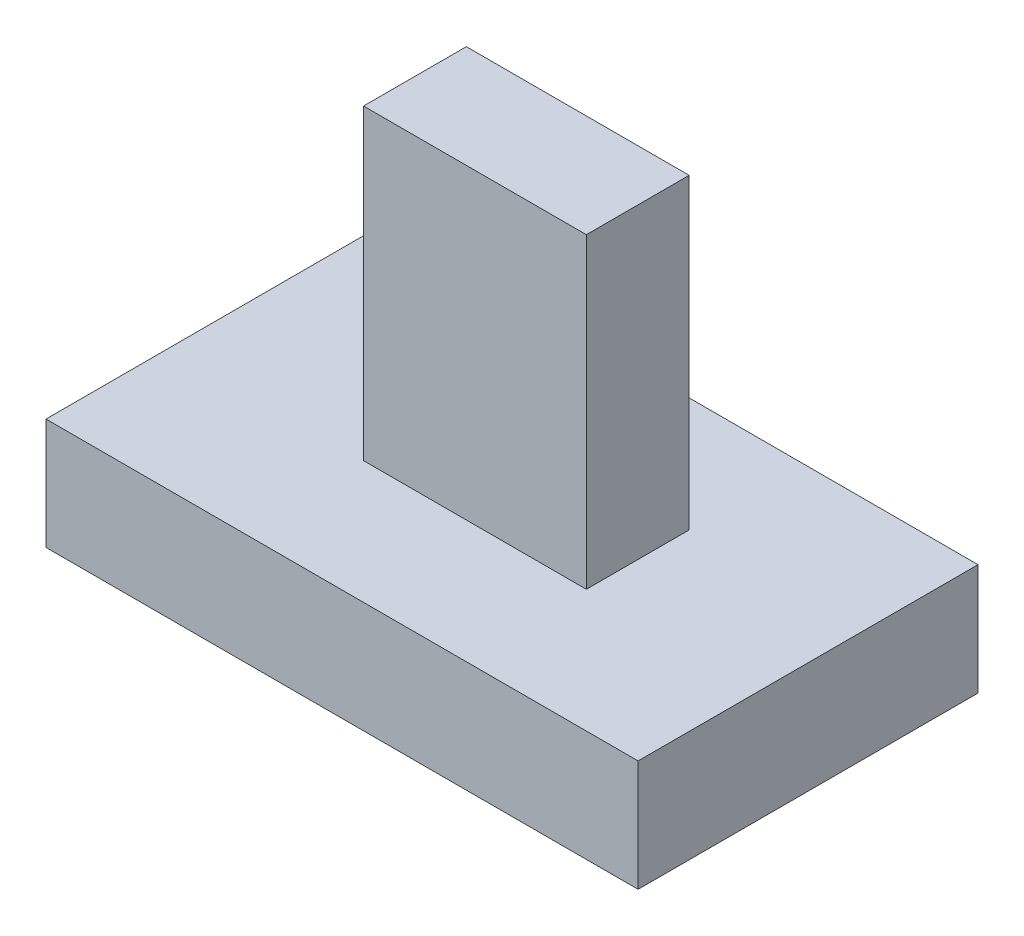
from build123d import *

# Parameters (mm, degrees)
SKETCH2_W           = 90.591455621
SKETCH2_H           = 52.006206005
BOSS_EXTRUDE1_DEPTH = 17.018
SKETCH4_W           = 34.091551214
SKETCH4_H           = 15.728929147
CUT_EXTRUDE2_DEPTH  = 46.99
SKETCH4_2_W         = 34.091551214
SKETCH4_2_H         = 15.728929147
BOSS_EXTRUDE2_DEPTH = 46.99


with BuildPart() as part:
    # Sketch2 → Boss-Extrude1 (new body)
    with BuildSketch(Plane(origin=(0, 0, 0), x_dir=(1, 0, 0), z_dir=(0, 1, 0))):
        with Locations((-0.67104782, -0.33552391)):
            Rectangle(SKETCH2_W, SKETCH2_H)
    extrude(amount=BOSS_EXTRUDE1_DEPTH)

    # Sketch4 → Cut-Extrude2 (cut)
    with BuildSketch(Plane(origin=(0, 17.018, 0), x_dir=(1, 0, 0), z_dir=(0, 1, 0))):
        with Locations((0.882057956, 0.305536675)):
            Rectangle(SKETCH4_W, SKETCH4_H)
    extrude(amount=-CUT_EXTRUDE2_DEPTH, mode=Mode.SUBTRACT)


with BuildPart() as body_2:
    # Sketch4<2> → Boss-Extrude2 (new body)
    with BuildSketch(Plane(origin=(0, 17.018, 0), x_dir=(1, 0, 0), z_dir=(0, 1, 0))):
        with Locations((0.882057956, 0.305536675)):
            Rectangle(SKETCH4_2_W, SKETCH4_2_H)
    extrude(amount=BOSS_EXTRUDE2_DEPTH)


solid = Compound([part.part, body_2.part])
